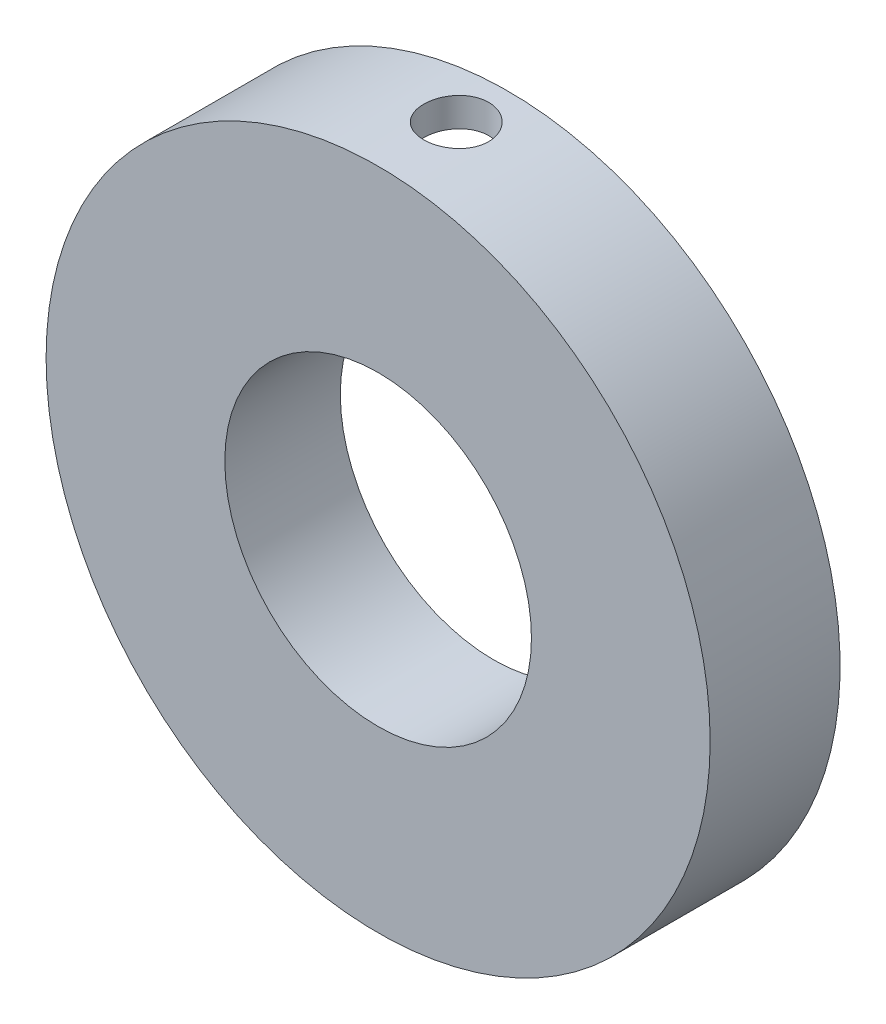
from build123d import *

# Parameters (mm, degrees)
SKETCH1_R           = 23
SKETCH1_R_2         = 10.62
BOSS_EXTRUDE1_DEPTH = 3
BOSS_EXTRUDE3_START = -8
SKETCH2_R           = 13
SKETCH2_R_2         = 10.62
BOSS_EXTRUDE3_DEPTH = 8
BOSS_EXTRUDE4_START = 6
SKETCH3_R           = 23
SKETCH3_R_2         = 21
BOSS_EXTRUDE4_DEPTH = 6
SKETCH4_R           = 1.25
CUT_EXTRUDE1_DEPTH  = 17
SKETCH4_3_R         = 2.25
CUT_EXTRUDE2_DEPTH  = 7


with BuildPart() as part:
    # Sketch1 → Boss-Extrude1 (new body)
    with BuildSketch(Plane.XY):
        Circle(SKETCH1_R)
        Circle(SKETCH1_R_2, mode=Mode.SUBTRACT)
    extrude(amount=BOSS_EXTRUDE1_DEPTH)

    # Sketch2 → Boss-Extrude3 (add)
    with BuildSketch(Plane.XY.offset(3).offset(BOSS_EXTRUDE3_START)):
        Circle(SKETCH2_R)
        Circle(SKETCH2_R_2, mode=Mode.SUBTRACT)
    extrude(amount=BOSS_EXTRUDE3_DEPTH)

    # Sketch3 → Boss-Extrude4 (add)
    with BuildSketch(Plane(origin=(0, 0, 0), x_dir=(-1, 0, 0), z_dir=(0, 0, -1)).offset(BOSS_EXTRUDE4_START)):
        Circle(SKETCH3_R)
        Circle(SKETCH3_R_2, mode=Mode.SUBTRACT)
    extrude(amount=-BOSS_EXTRUDE4_DEPTH)

    # Sketch4 → Cut-Extrude1 (cut)
    with BuildSketch(Plane(origin=(0, 24.918884167, 0), x_dir=(1, 0, 0), z_dir=(0, 1, 0))):
        with Locations((0, 2.407178774)):
            Circle(SKETCH4_R)
    extrude(amount=-CUT_EXTRUDE1_DEPTH, mode=Mode.SUBTRACT)

    # Sketch4<3> → Cut-Extrude2 (cut)
    with BuildSketch(Plane(origin=(0, 24.918884167, 0), x_dir=(1, 0, 0), z_dir=(0, 1, 0))):
        with Locations((0, 2.407178774)):
            Circle(SKETCH4_3_R)
    extrude(amount=-CUT_EXTRUDE2_DEPTH, mode=Mode.SUBTRACT)


solid = part.part
